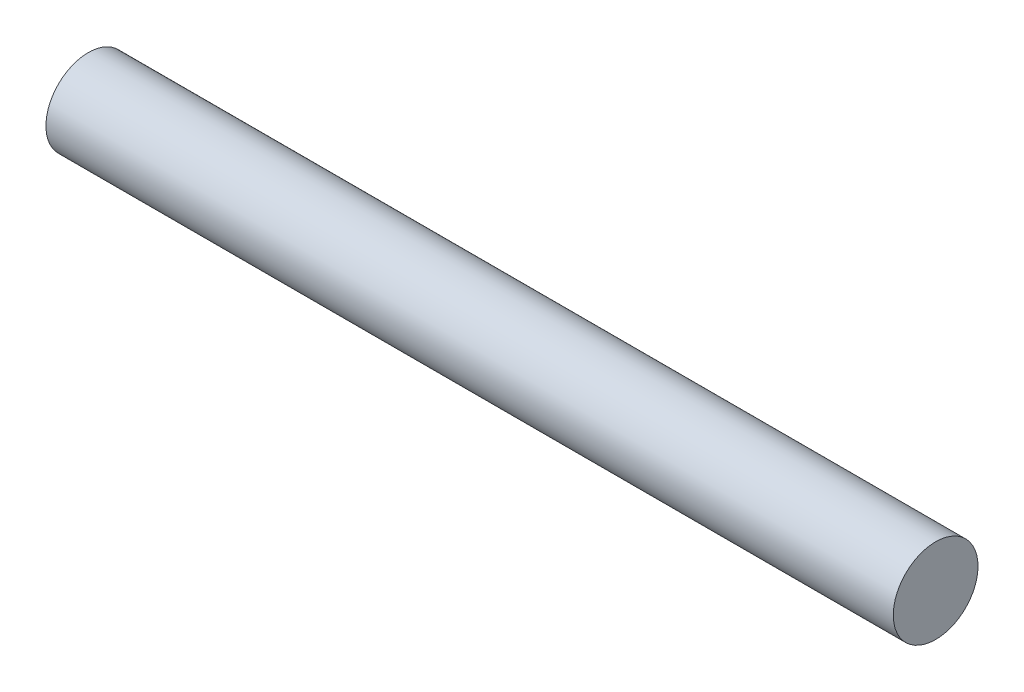
from build123d import *

# Parameters (mm, degrees)
SKETCH1_R           = 3.175
BOSS_EXTRUDE1_DEPTH = 63.5


with BuildPart() as part:
    # Sketch1 → Boss-Extrude1 (new body)
    with BuildSketch(Plane(origin=(0, 0, 0), x_dir=(0, 0, -1), z_dir=(1, 0, 0))):
        Circle(SKETCH1_R)
    extrude(amount=BOSS_EXTRUDE1_DEPTH)


solid = part.part
